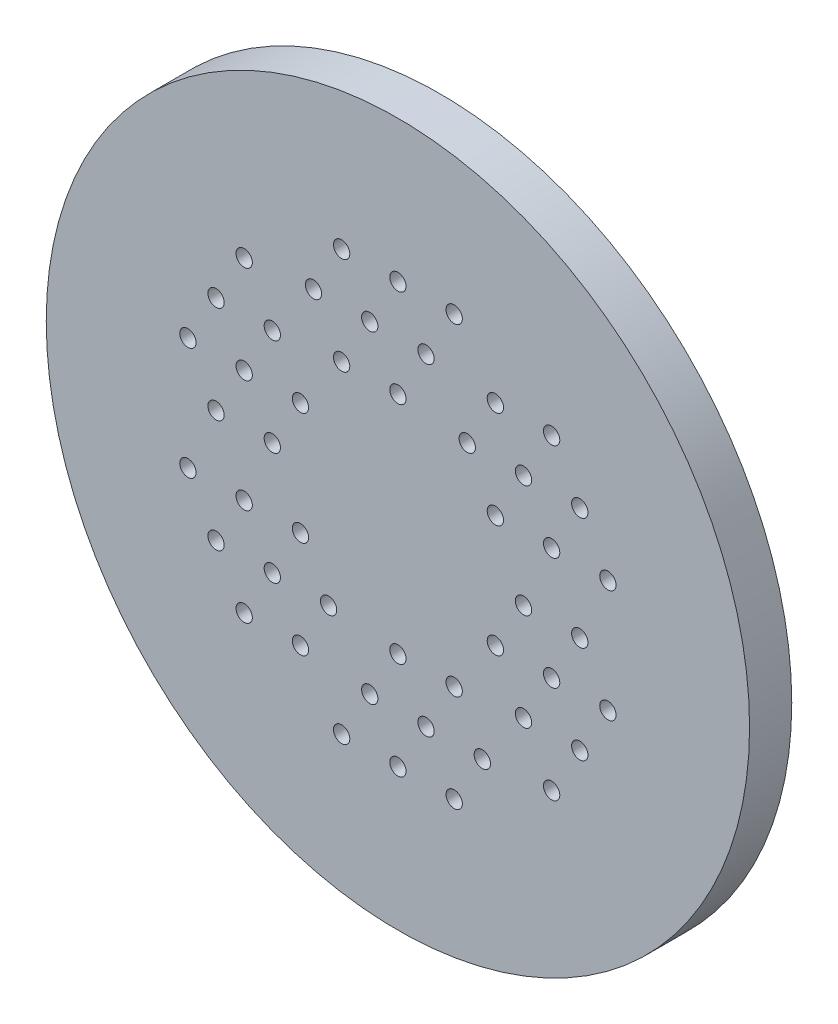
from build123d import *

# Parameters (mm, degrees)
SKETCH1_R               = 76.2
BOSS_EXTRUDE1_DEPTH     = 3.81
SKETCH2_R               = 0.7366
CUT_EXTRUDE1_DEPTH      = 108.830404339
CIRPATTERN1_COUNT       = 6
SKETCH3_R               = 6.35
CUT_EXTRUDE2_DEPTH      = 108.830404339
SKETCH5_R               = 3.175
CUT_EXTRUDE3_DEPTH      = 108.830404339
CIRPATTERN2_COUNT       = 8
SKETCH6_W               = 1.27
SKETCH6_H               = 2.54
CUT_EXTRUDE4_DEPTH      = 108.830404339
CUT_EXTRUDE4_DEPTH_BACK = 108.830404339
SKETCH7_R               = 76.2
SKETCH7_R_2             = 31.75


with BuildPart() as part:
    # Sketch1 → Boss-Extrude1 (new body)
    with BuildSketch(Plane.XY):
        with Locations(Location((0, 0, 0), (0, 0, 180))):
            Circle(SKETCH1_R)
    extrude(amount=BOSS_EXTRUDE1_DEPTH)

    # Sketch2 → Cut-Extrude1 (cut, through all)
    with BuildSketch(Plane(origin=(0, 0, 0), x_dir=(-1, 0, 0), z_dir=(0, 0, -1))):
        with Locations((0, 10.16)):
            Circle(SKETCH2_R)
        with Locations((2.54, 14.559409051)):
            Circle(SKETCH2_R)
        with Locations((5.08, 10.16)):
            Circle(SKETCH2_R)
        with Locations((7.62, 14.559409051)):
            Circle(SKETCH2_R)
        with Locations((-2.54, 14.559409051)):
            Circle(SKETCH2_R)
        with Locations((-5.08, 18.958818102)):
            Circle(SKETCH2_R)
        with Locations((0, 18.958818102)):
            Circle(SKETCH2_R)
        with Locations((5.08, 18.958818102)):
            Circle(SKETCH2_R)
    cut_extrude1 = extrude(amount=-CUT_EXTRUDE1_DEPTH, mode=Mode.SUBTRACT)

    # CirPattern1: Cut-Extrude1 ×6 about axis
    cirpattern1_axis = Axis((0, 0, 0), (0, 0, 1))
    for i in range(1, CIRPATTERN1_COUNT):
        add(cut_extrude1.rotate(cirpattern1_axis, i * 360 / CIRPATTERN1_COUNT), mode=Mode.SUBTRACT)

    # Sketch3 → Cut-Extrude2 (cut, through all)
    with BuildSketch(Plane(origin=(0, 0, 0), x_dir=(-1, 0, 0), z_dir=(0, 0, -1))):
        with Locations((41.275, 0)):
            Circle(SKETCH3_R)
        with Locations((-41.275, 0)):
            Circle(SKETCH3_R)
    extrude(amount=-CUT_EXTRUDE2_DEPTH, mode=Mode.SUBTRACT)

    # Sketch5 → Cut-Extrude3 (cut, through all)
    with BuildSketch(Plane(origin=(0, 0, 0), x_dir=(-1, 0, 0), z_dir=(0, 0, -1))):
        with Locations((66.802, 0)):
            Circle(SKETCH5_R)
    cut_extrude3 = extrude(amount=-CUT_EXTRUDE3_DEPTH, mode=Mode.SUBTRACT)

    # CirPattern2: Cut-Extrude3 ×8 about axis
    cirpattern2_axis = Axis((0, 0, 0), (0, 0, 1))
    for i in range(1, CIRPATTERN2_COUNT):
        add(cut_extrude3.rotate(cirpattern2_axis, i * 360 / CIRPATTERN2_COUNT), mode=Mode.SUBTRACT)

    # Sketch6 → Revolve1 (revolve)
    with BuildSketch(Plane(origin=(0, 0, 0), x_dir=(0, 0, -1), z_dir=(1, 0, 0))):
        with Locations((0.635, 52.07)):
            Rectangle(SKETCH6_W, SKETCH6_H)
    revolve(axis=Axis((0, 0, 0), (0, 0, 1)))

    # Sketch7 → Cut-Extrude4 (cut, two sides: drawn at the far end of the back side and taken through both)
    with BuildSketch(Plane.XY.offset(-CUT_EXTRUDE4_DEPTH_BACK)):
        Circle(SKETCH7_R)
        with Locations(Location((0, 0, 0), (0, 0, 180))):
            Circle(SKETCH7_R_2, mode=Mode.SUBTRACT)
    extrude(amount=CUT_EXTRUDE4_DEPTH + CUT_EXTRUDE4_DEPTH_BACK, mode=Mode.SUBTRACT)


solid = part.part
